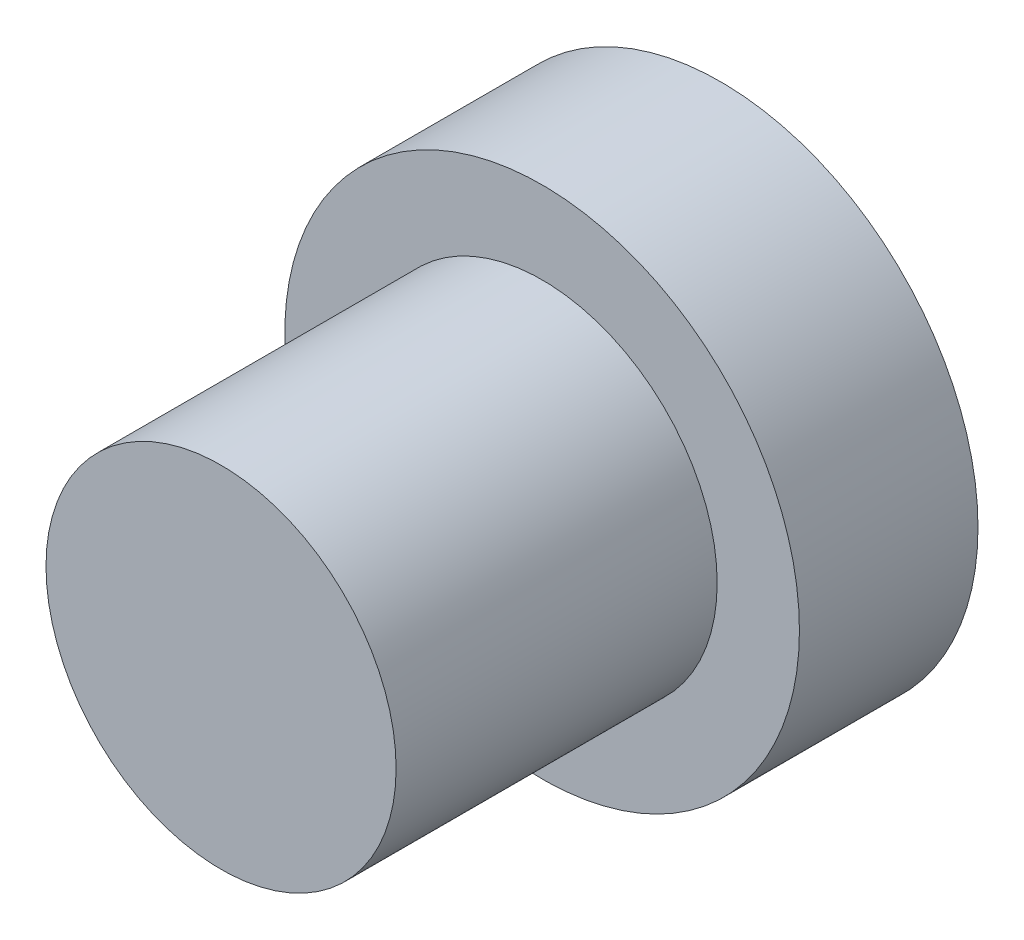
from build123d import *

# Parameters (mm, degrees)
SKETCH1_R           = 7.35
BOSS_EXTRUDE1_DEPTH = 5.1
SKETCH2_R           = 5
BOSS_EXTRUDE2_DEPTH = 9.17


with BuildPart() as part:
    # Sketch1 → Boss-Extrude1 (new body)
    with BuildSketch(Plane.XY):
        Circle(SKETCH1_R)
    extrude(amount=BOSS_EXTRUDE1_DEPTH)

    # Sketch2 → Boss-Extrude2 (add)
    with BuildSketch(Plane.XY.offset(5.1)):
        Circle(SKETCH2_R)
    extrude(amount=BOSS_EXTRUDE2_DEPTH)


solid = part.part
